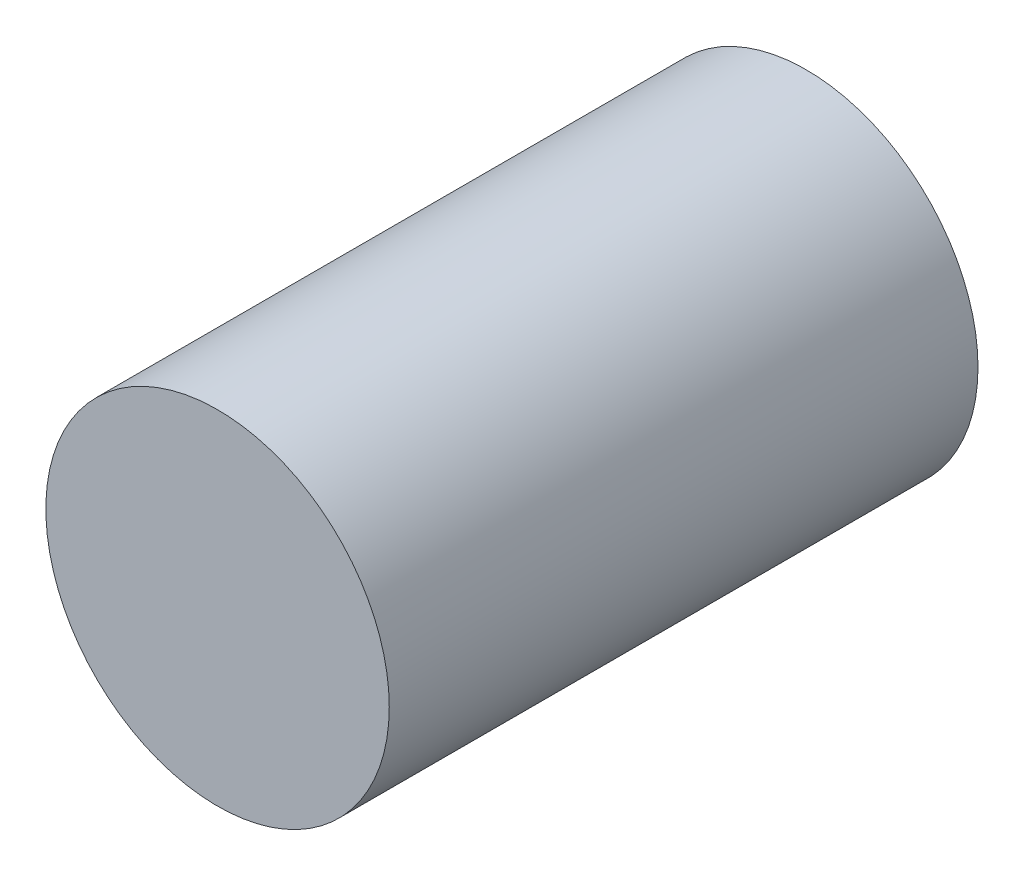
from build123d import *

# Parameters (mm, degrees)
SKETCH1_R           = 7
BOSS_EXTRUDE1_DEPTH = 24


with BuildPart() as part:
    # Sketch1 → Boss-Extrude1 (new body)
    with BuildSketch(Plane.XY):
        Circle(SKETCH1_R)
    extrude(amount=BOSS_EXTRUDE1_DEPTH)


solid = part.part
